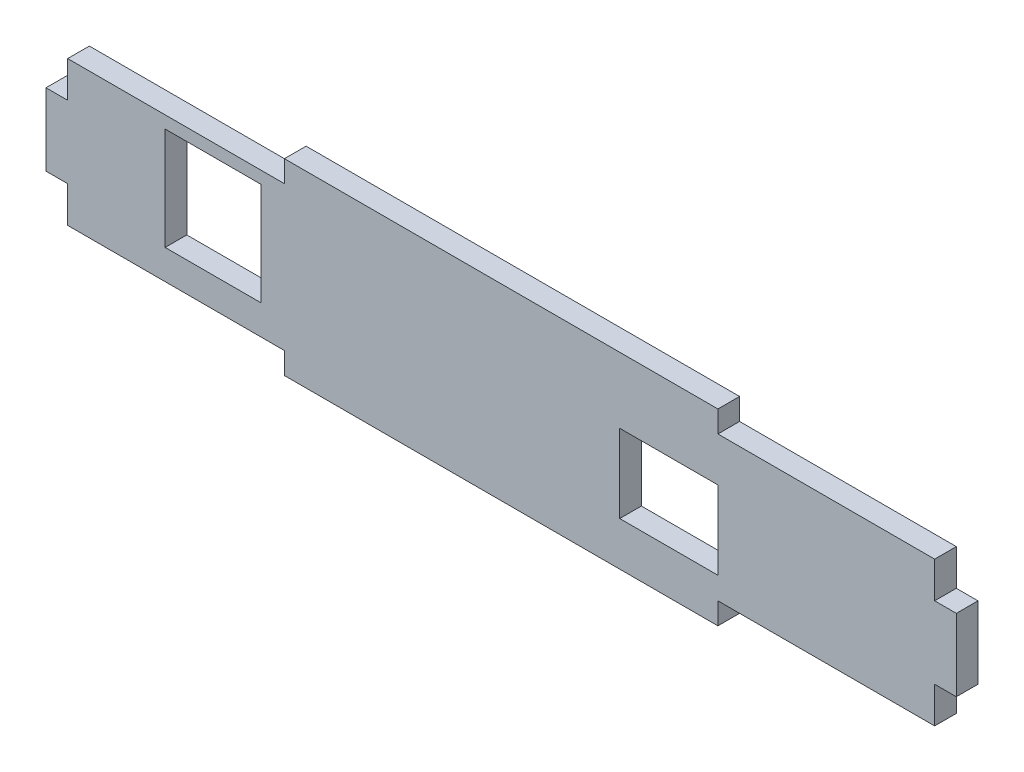
from build123d import *

# Parameters (mm, degrees)
SKETCH1_W           = 13.261595532
SKETCH1_H           = 14.197229573
SKETCH1_W_2         = 13.589928323
SKETCH1_H_2         = 10.821492273
BOSS_EXTRUDE1_DEPTH = 3


with BuildPart() as part:
    # Sketch1 → Boss-Extrude1 (new body)
    with BuildSketch(Plane.XY):
        Polygon((0, 0), (0, 5), (-3, 5), (-3, 15), (0, 15), (0, 20), (30, 20), (30, 23), (90, 23), (90, 20), (120, 20), (120, 15), (123, 15), (123, 5), (120, 5), (120, 0), (90, 0), (90, -3), (30, -3), (30, 0), align=None)
        with Locations((20.120769768, 11.201101938)):
            Rectangle(SKETCH1_W, SKETCH1_H, mode=Mode.SUBTRACT)
        with Locations((83.205035839, 8.477370375)):
            Rectangle(SKETCH1_W_2, SKETCH1_H_2, mode=Mode.SUBTRACT)
    extrude(amount=BOSS_EXTRUDE1_DEPTH)


solid = part.part
